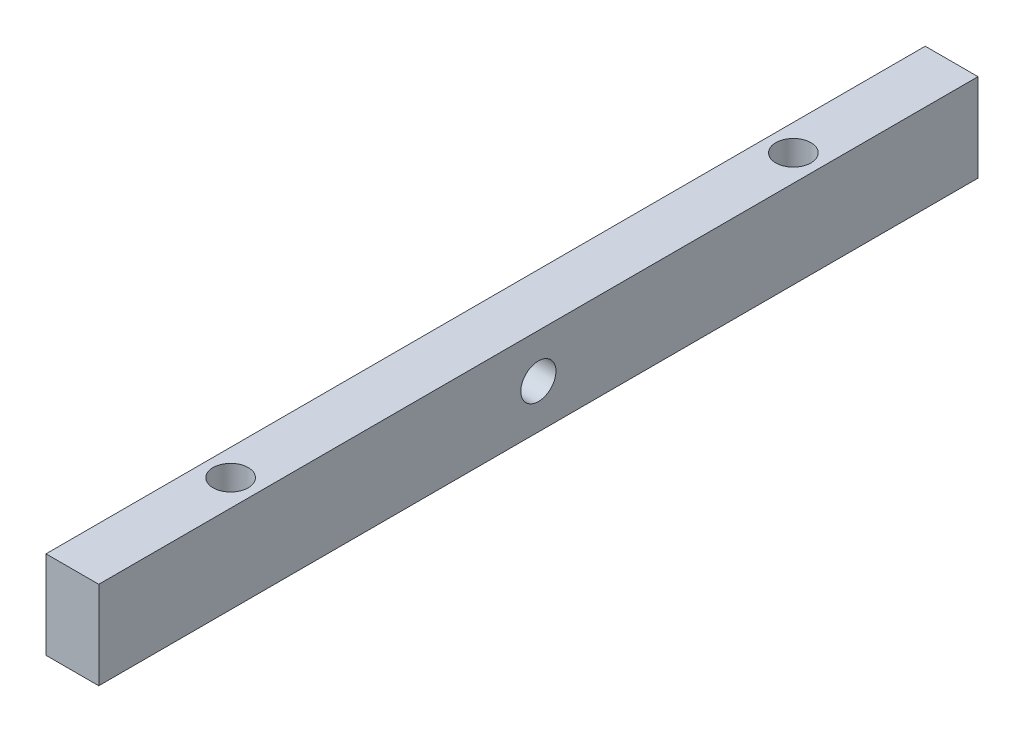
from build123d import *

# Parameters (mm, degrees)
SKETCH_1_W          = 30
SKETCH_1_H          = 50
EXTRUDE_1_DEPTH     = 500
SKETCH_2_R          = 10
CUT_EXTRUDE_1_DEPTH = 503.717614571
SKETCH_3_R          = 10
CUT_EXTRUDE_2_DEPTH = 502.522681441


with BuildPart() as part:
    # Эскиз1 → Бобышка-Вытянуть1 (new body)
    with BuildSketch(Plane.XY):
        Rectangle(SKETCH_1_W, SKETCH_1_H)
    extrude(amount=EXTRUDE_1_DEPTH)

    # Эскиз2 → Вырез-Вытянуть1 (cut, through all)
    with BuildSketch(Plane(origin=(0, 25, 0), x_dir=(1, 0, 0), z_dir=(0, 1, 0))):
        with Locations(Location((0, -90, 0), (0, 0, 270))):
            Circle(SKETCH_2_R)
        with Locations(Location((0, -410, 0), (0, 0, 90))):
            Circle(SKETCH_2_R)
    extrude(amount=-CUT_EXTRUDE_1_DEPTH, mode=Mode.SUBTRACT)

    # Эскиз3 → Вырез-Вытянуть2 (cut, through all)
    with BuildSketch(Plane.ZY.offset(15)):
        with Locations(Location((250, 0, 0), (0, 0, 270))):
            Circle(SKETCH_3_R)
    extrude(amount=-CUT_EXTRUDE_2_DEPTH, mode=Mode.SUBTRACT)


solid = part.part
